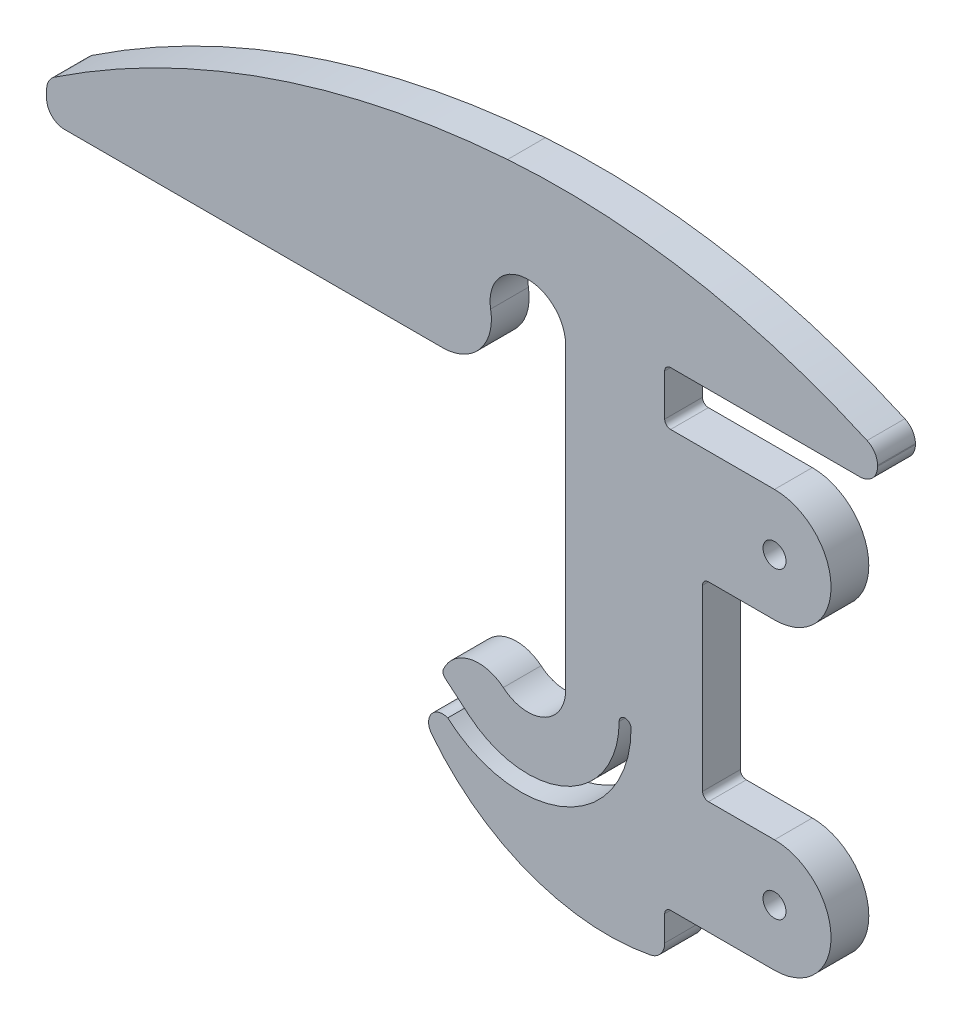
from build123d import *

# Parameters (mm, degrees)
BOSS_EXTRUDE1_DEPTH = 3.175
FILLET1_R           = 0.5
CUT_EXTRUDE2_REACH  = 51.643
SKETCH3_R           = 0.9652
FILLET2_R           = 1.5


with BuildPart() as part:
    # Model → Boss-Extrude1 (new body)
    with BuildSketch(Plane.XY):
        with BuildLine():
            Line((14.682892141, 1.324956628), (14.682892141, -14.675043372))
            Line((14.682892141, -14.675043372), (20.7298505, -14.675043372))
            ThreePointArc((20.7298505, -14.675043372), (25.4798505, -19.425043372), (20.7298505, -24.175043372))
            Line((20.7298505, -24.175043372), (11.5, -24.175043372))
            Line((11.5, -24.175043372), (11.5, -28.004155183))
            ThreePointArc((11.5, -28.004155183), (0.71022918, -27.624612518), (-8.091185045, -21.371748005))
            ThreePointArc((-8.091185045, -21.371748005), (-8.108719309, -19.937278968), (-6.731529764, -19.535585272))
            ThreePointArc((-6.731529764, -19.535585272), (3.21430247, -21.04378196), (8.674974651, -12.595391853))
            ThreePointArc((8.674974651, -12.595391853), (8.175614462, -12.09535774), (7.674976202, -12.594112234))
            ThreePointArc((7.674976202, -12.594112234), (3.234931854, -19.534945465), (-4.933394903, -18.4543911))
            Line((-4.933394903, -18.4543911), (-7.231528234, -16.526028271))
            ThreePointArc((-7.231528234, -16.526028271), (-5.055570769, -14.381233606), (-2.061467679, -14.989741395))
            ThreePointArc((-2.061467679, -14.989741395), (1.32956104, -15.458208706), (3.175, -12.575000001))
            Line((3.175, -12.575000001), (3.175, 12.575000001))
            ThreePointArc((3.175, 12.575000001), (-0.276719482, 15.737918167), (-3.126764616, 12.023667038))
            ThreePointArc((-3.126764616, 12.023667038), (-4.027590212, 8.661740144), (-7.182015159, 7.190807634))
            Line((-7.182015159, 7.190807634), (-38.940555286, 7.190807634))
            ThreePointArc((-38.940555286, 7.190807634), (-40.001215458, 7.630147462), (-40.440555286, 8.690807634))
            Line((-40.440555286, 8.690807634), (-40.440555286, 9.332781994))
            ThreePointArc((-40.440555286, 9.332781994), (-40.26291966, 10.040844464), (-39.772085337, 10.581204108))
            ThreePointArc((-39.772085337, 10.581204108), (-21.582497329, 19.5655863), (-1.704175076, 23.619293202))
            ThreePointArc((-1.704175076, 23.619293202), (14.213621823, 22.738093196), (29.39280733, 17.865198893))
            Line((29.39280733, 17.865198893), (29.39280733, 15.324956628))
            Line((29.39280733, 15.324956628), (11.5, 15.324956628))
            Line((11.5, 15.324956628), (11.5, 10.824956628))
            Line((11.5, 10.824956628), (20.7298505, 10.824956628))
            ThreePointArc((20.7298505, 10.824956628), (25.4798505, 6.074956628), (20.7298505, 1.324956628))
            Line((20.7298505, 1.324956628), (14.682892141, 1.324956628))
        make_face()
    extrude(amount=BOSS_EXTRUDE1_DEPTH)

    # Fillet1
    fillet1_edges = [part.edges().sort_by_distance(p)[0] for p in [
        (11.5, 15.324956628, 1.5875),
        (11.5, 10.824956628, 1.5875),
        (14.682892141, 1.324956628, 1.5875),
        (14.682892141, -14.675043372, 1.5875),
        (11.5, -24.175043372, 1.5875),
        (-7.231528234, -16.526028271, 1.5875),
    ]]
    fillet(fillet1_edges, radius=FILLET1_R)

    # Sketch3 → Cut-Extrude2 (cut, up to next)
    with BuildSketch(Plane(origin=(0, 0, 0), x_dir=(-1, 0, 0), z_dir=(0, 0, -1)), mode=Mode.PRIVATE) as cut_extrude2_sk1:
        with Locations((-20.7298505, 6.074956628)):
            Circle(SKETCH3_R)
    cut_extrude2_tool1 = extrude(cut_extrude2_sk1.sketch, amount=-CUT_EXTRUDE2_REACH, mode=Mode.PRIVATE) & part.part
    # Sketch3 → Cut-Extrude2 (cut, up to next)
    with BuildSketch(Plane(origin=(0, 0, 0), x_dir=(-1, 0, 0), z_dir=(0, 0, -1)), mode=Mode.PRIVATE) as cut_extrude2_sk2:
        with Locations((-20.7298505, -19.425043372)):
            Circle(SKETCH3_R)
    cut_extrude2_tool2 = extrude(cut_extrude2_sk2.sketch, amount=-CUT_EXTRUDE2_REACH, mode=Mode.PRIVATE) & part.part
    add(cut_extrude2_tool1.solids().sort_by_distance((20.729851, 6.074957, 0))[0], mode=Mode.SUBTRACT)
    add(cut_extrude2_tool2.solids().sort_by_distance((20.729851, -19.425043, 0))[0], mode=Mode.SUBTRACT)

    # Fillet2
    fillet2_edges = [part.edges().sort_by_distance(p)[0] for p in [
        (29.39280733, 17.865198893, 1.5875),
        (29.39280733, 15.324956628, 1.5875),
        (11.5, -28.004155183, 1.5875),
    ]]
    fillet(fillet2_edges, radius=FILLET2_R)


solid = part.part
